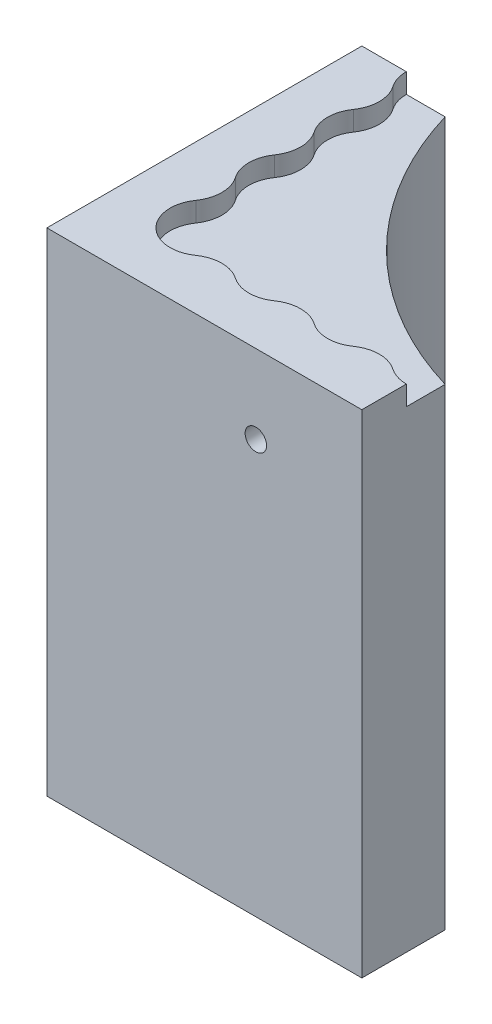
from build123d import *

# Parameters (mm, degrees)
SKETCH1_W                 = 50.8
SKETCH1_H                 = 50.8
BOSS_EXTRUDE1_DEPTH       = 79.375
CUT_EXTRUDE1_DEPTH        = 3.175
SKETCH3_R                 = 55.5625
CUT_EXTRUDE2_DEPTH        = 108.059192156
F_8_32_TAPPED_HOLE1_D     = 3.4544
F_8_32_TAPPED_HOLE1_DEPTH = 10.70864
F_8_32_TAPPED_HOLE1_TIP   = 1.037806461
F_8_32_TAPPED_HOLE2_D     = 3.4544
F_8_32_TAPPED_HOLE2_DEPTH = 10.70864
F_8_32_TAPPED_HOLE2_TIP   = 1.037806461


with BuildPart() as part:
    # Sketch1 → Boss-Extrude1 (new body)
    with BuildSketch(Plane(origin=(0, 0, 0), x_dir=(1, 0, 0), z_dir=(0, 1, 0))):
        with Locations((25.4, 25.4)):
            Rectangle(SKETCH1_W, SKETCH1_H)
    extrude(amount=BOSS_EXTRUDE1_DEPTH)

    # Sketch2 → Cut-Extrude1 (cut)
    with BuildSketch(Plane(origin=(0, 79.375, 0), x_dir=(1, 0, 0), z_dir=(0, 1, 0))):
        with BuildLine():
            Line((130.016993909, 125.017737196), (134.25782275, 78.573759143))
            ThreePointArc((134.25782275, 78.573759143), (134.034685181, 75.298190088), (132.798116214, 72.256802214))
            ThreePointArc((132.798116214, 72.256802214), (130.01096738, 66.280890285), (128.580118229, 59.844090402))
            ThreePointArc((128.580118229, 59.844090402), (125.846501332, 47.24207899), (120.576283082, 35.473130329))
            ThreePointArc((120.576283082, 35.473130329), (120.013426501, 34.114565768), (119.824473194, 32.656209898))
            ThreePointArc((119.824473194, 32.656209898), (117.90735564, 28.45485307), (113.469501546, 27.177281171))
            ThreePointArc((113.469501546, 27.177281171), (106.116591491, 23.83727612), (106.198458812, 15.761744078))
            ThreePointArc((106.198458812, 15.761744078), (105.465515747, 8.75311664), (98.443142857, 8.166309094))
            ThreePointArc((98.443142857, 8.166309094), (95.25, 9.168506799), (92.056857143, 8.166309094))
            ThreePointArc((92.056857143, 8.166309094), (88.9, 7.1755), (85.743142857, 8.166309094))
            ThreePointArc((85.743142857, 8.166309094), (82.55, 9.168506799), (79.356857143, 8.166309094))
            ThreePointArc((79.356857143, 8.166309094), (76.212257074, 7.175513597), (73.063291467, 8.152345678))
            ThreePointArc((73.063291467, 8.152345678), (69.907489389, 9.140393728), (66.74574768, 8.171520637))
            ThreePointArc((66.74574768, 8.171520637), (63.508942298, 7.175501389), (60.273525168, 8.176020964))
            ThreePointArc((60.273525168, 8.176020964), (57.10532095, 9.149271709), (53.943097961, 8.156759366))
            ThreePointArc((53.943097961, 8.156759366), (50.791625748, 7.175506347), (47.643142857, 8.166309094))
            ThreePointArc((47.643142857, 8.166309094), (44.45, 9.168506799), (41.256857143, 8.166309094))
            ThreePointArc((41.256857143, 8.166309094), (38.1, 7.1755), (34.943142857, 8.166309094))
            ThreePointArc((34.943142857, 8.166309094), (31.75, 9.168506799), (28.556857143, 8.166309094))
            ThreePointArc((28.556857143, 8.166309094), (25.4, 7.1755), (22.243142857, 8.166309094))
            ThreePointArc((22.243142857, 8.166309094), (19.05, 9.168506799), (15.856857143, 8.166309094))
            ThreePointArc((15.856857143, 8.166309094), (8.793588587, 8.793588587), (8.166309094, 15.856857143))
            ThreePointArc((8.166309094, 15.856857143), (9.168506799, 19.05), (8.166309094, 22.243142857))
            ThreePointArc((8.166309094, 22.243142857), (7.1755, 25.4), (8.166309094, 28.556857143))
            ThreePointArc((8.166309094, 28.556857143), (9.168506799, 31.75), (8.166309094, 34.943142857))
            ThreePointArc((8.166309094, 34.943142857), (7.1755, 38.1), (8.166309094, 41.256857143))
            ThreePointArc((8.166309094, 41.256857143), (9.168506799, 44.45), (8.166309094, 47.643142857))
            ThreePointArc((8.166309094, 47.643142857), (7.175506347, 50.791625748), (8.156759366, 53.943097961))
            ThreePointArc((8.156759366, 53.943097961), (9.149271709, 57.10532095), (8.176020964, 60.273525168))
            ThreePointArc((8.176020964, 60.273525168), (7.175501389, 63.508942298), (8.171520637, 66.74574768))
            ThreePointArc((8.171520637, 66.74574768), (9.140393728, 69.907489389), (8.152345678, 73.063291467))
            ThreePointArc((8.152345678, 73.063291467), (7.175513597, 76.212257074), (8.166309094, 79.356857143))
            ThreePointArc((8.166309094, 79.356857143), (9.168506799, 82.55), (8.166309094, 85.743142857))
            ThreePointArc((8.166309094, 85.743142857), (7.1755, 88.9), (8.166309094, 92.056857143))
            ThreePointArc((8.166309094, 92.056857143), (9.168506799, 95.25), (8.166309094, 98.443142857))
            ThreePointArc((8.166309094, 98.443142857), (8.75311664, 105.465515747), (15.761744078, 106.198458812))
            ThreePointArc((15.761744078, 106.198458812), (23.83727612, 106.116591491), (27.177281171, 113.469501546))
            ThreePointArc((27.177281171, 113.469501546), (28.45485307, 117.90735564), (32.656209898, 119.824473194))
            ThreePointArc((32.656209898, 119.824473194), (34.114565768, 120.013426501), (35.473130329, 120.576283082))
            ThreePointArc((35.473130329, 120.576283082), (47.24207899, 125.846501332), (59.844090402, 128.580118229))
            ThreePointArc((59.844090402, 128.580118229), (68.705211612, 130.952457845), (76.452938417, 135.863689229))
            ThreePointArc((76.452938417, 135.863689229), (80.625736152, 138.0725352), (85.345346996, 138.201045691))
            Line((85.345346996, 138.201045691), (125.626948268, 129.926898817))
            ThreePointArc((125.626948268, 129.926898817), (128.63345164, 128.197989094), (130.016993909, 125.017737196))
        make_face()
    extrude(amount=-CUT_EXTRUDE1_DEPTH, mode=Mode.SUBTRACT)

    # Sketch3 → Cut-Extrude2 (cut, through all)
    with BuildSketch(Plane(origin=(0, 79.375, 0), x_dir=(1, 0, 0), z_dir=(0, 1, 0))):
        with Locations((66.675, 66.675)):
            Circle(SKETCH3_R)
    extrude(amount=-CUT_EXTRUDE2_DEPTH, mode=Mode.SUBTRACT)

    # #8-32 Tapped Hole1
    with Locations(Plane(origin=(393.7, -15.875, 0), x_dir=(1, 0, 0), z_dir=(0, 0, 1))):
        with Locations((-300, 82.55), (-240, 82.55), (-180, 82.55), (-60, 82.55), (0, 82.55), (60, 82.55), (120, 82.55), (180, 82.55), (240, 82.55), (-120, 82.55), (-360, 82.55), (300, 82.55), (360, 82.55)):
            Hole(F_8_32_TAPPED_HOLE1_D / 2, depth=F_8_32_TAPPED_HOLE1_DEPTH)
            with Locations((0, 0, -(F_8_32_TAPPED_HOLE1_DEPTH + F_8_32_TAPPED_HOLE1_TIP / 2))):  # 118° drill point
                Cone(0, F_8_32_TAPPED_HOLE1_D / 2, F_8_32_TAPPED_HOLE1_TIP, mode=Mode.SUBTRACT)

    # #8-32 Tapped Hole2
    with Locations(Plane(origin=(0, -15.875, -393.7), x_dir=(0, 0, 1), z_dir=(-1, 0, 0))):
        with Locations((-300, 82.55), (-240, 82.55), (-180, 82.55), (-60, 82.55), (0, 82.55), (60, 82.55), (120, 82.55), (180, 82.55), (240, 82.55), (-120, 82.55), (-360, 82.55), (300, 82.55), (360, 82.55)):
            Hole(F_8_32_TAPPED_HOLE2_D / 2, depth=F_8_32_TAPPED_HOLE2_DEPTH)
            with Locations((0, 0, -(F_8_32_TAPPED_HOLE2_DEPTH + F_8_32_TAPPED_HOLE2_TIP / 2))):  # 118° drill point
                Cone(0, F_8_32_TAPPED_HOLE2_D / 2, F_8_32_TAPPED_HOLE2_TIP, mode=Mode.SUBTRACT)


solid = part.part
